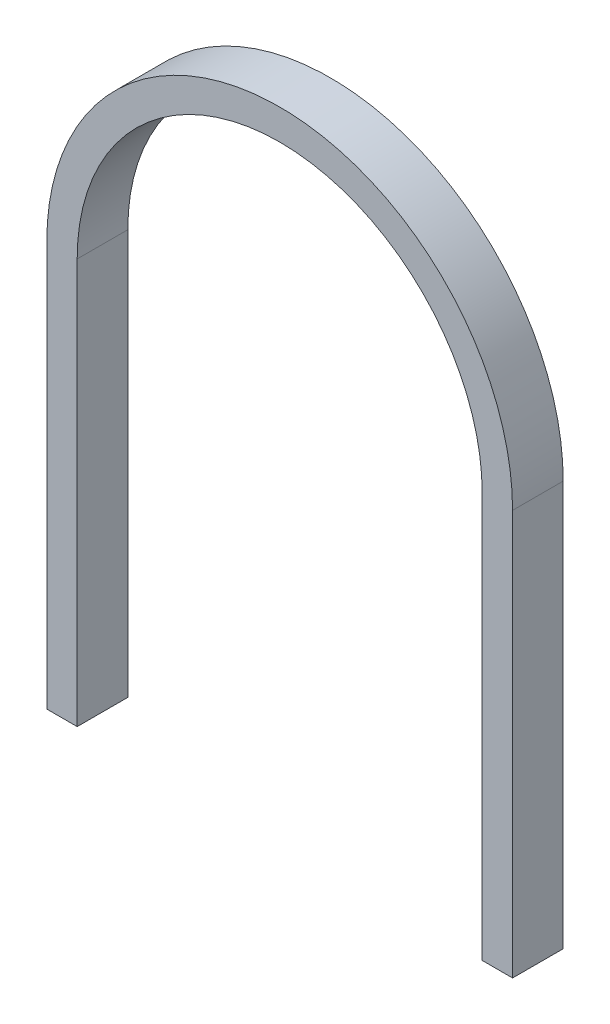
from build123d import *

# Parameters (mm, degrees)
BOSS_EXTRU_1_DEPTH = 5


with BuildPart() as part:
    # Esquisse1 → Boss.-Extru.1 (new body)
    with BuildSketch(Plane.XY):
        with BuildLine():
            Line((-20, 0), (-20, 40))
            ThreePointArc((-20, 40), (0, 60), (20, 40))
            Line((20, 40), (20, 0))
            Line((20, 0), (23, 0))
            Line((23, 0), (23, 40))
            ThreePointArc((23, 40), (0, 63), (-23, 40))
            Line((-23, 40), (-23, 0))
            Line((-23, 0), (-20, 0))
        make_face()
    extrude(amount=BOSS_EXTRU_1_DEPTH)


solid = part.part
